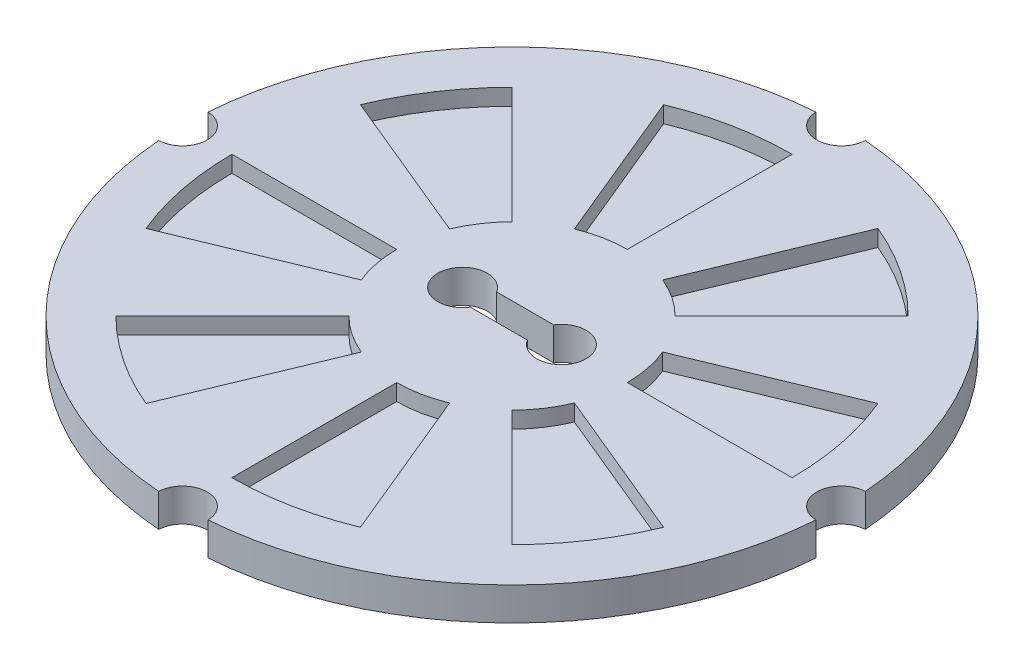
from build123d import *

# Parameters (mm, degrees)
SKETCH1_R           = 127
BOSS_EXTRUDE1_DEPTH = 12.7
CUT_EXTRUDE1_DEPTH  = 6.35
CUT_EXTRUDE2_DEPTH  = 181.05357536
SKETCH4_R           = 9.525
CUT_EXTRUDE3_DEPTH  = 181.05357536


with BuildPart() as part:
    # Sketch1 → Boss-Extrude1 (new body)
    with BuildSketch(Plane(origin=(0, 0, 0), x_dir=(1, 0, 0), z_dir=(0, 1, 0))):
        with Locations(Location((0, 0, 0), (0, 0, 90))):
            Circle(SKETCH1_R)
    extrude(amount=BOSS_EXTRUDE1_DEPTH)

    # Sketch2 → Cut-Extrude1 (cut)
    with BuildSketch(Plane(origin=(0, 12.7, 0), x_dir=(1, 0, 0), z_dir=(0, 1, 0))):
        with BuildLine():
            Line((44.45, 0), (107.95, 0))
            ThreePointArc((107.95, 0), (105.87577102, 21.060000262), (99.732795535, 41.310676524))
            Line((99.732795535, 41.310676524), (41.06644522, 17.010278569))
            ThreePointArc((41.06644522, 17.010278569), (43.595905714, 8.671764814), (44.45, 0))
        make_face()
        with BuildLine():
            Line((41.06644522, -17.010278569), (99.732795535, -41.310676524))
            ThreePointArc((99.732795535, -41.310676524), (89.757144648, -59.973806654), (76.332177029, -76.332177029))
            Line((76.332177029, -76.332177029), (31.430896424, -31.430896424))
            ThreePointArc((31.430896424, -31.430896424), (36.958824267, -24.695096858), (41.06644522, -17.010278569))
        make_face()
        with BuildLine():
            Line((17.010278569, -41.06644522), (41.310676524, -99.732795535))
            ThreePointArc((41.310676524, -99.732795535), (21.060000262, -105.87577102), (0, -107.95))
            Line((0, -107.95), (0, -44.45))
            ThreePointArc((0, -44.45), (8.671764814, -43.595905714), (17.010278569, -41.06644522))
        make_face()
        with BuildLine():
            Line((-17.010278569, -41.06644522), (-41.310676524, -99.732795535))
            ThreePointArc((-41.310676524, -99.732795535), (-59.973806654, -89.757144648), (-76.332177029, -76.332177029))
            Line((-76.332177029, -76.332177029), (-31.430896424, -31.430896424))
            ThreePointArc((-31.430896424, -31.430896424), (-24.695096858, -36.958824267), (-17.010278569, -41.06644522))
        make_face()
        with BuildLine():
            Line((-41.06644522, -17.010278569), (-99.732795535, -41.310676524))
            ThreePointArc((-99.732795535, -41.310676524), (-105.87577102, -21.060000262), (-107.95, 0))
            Line((-107.95, 0), (-44.45, 0))
            ThreePointArc((-44.45, 0), (-43.595905714, -8.671764814), (-41.06644522, -17.010278569))
        make_face()
        with BuildLine():
            Line((-41.06644522, 17.010278569), (-99.732795535, 41.310676524))
            ThreePointArc((-99.732795535, 41.310676524), (-89.757144648, 59.973806654), (-76.332177029, 76.332177029))
            Line((-76.332177029, 76.332177029), (-31.430896424, 31.430896424))
            ThreePointArc((-31.430896424, 31.430896424), (-36.958824267, 24.695096858), (-41.06644522, 17.010278569))
        make_face()
        with BuildLine():
            Line((-17.010278569, 41.06644522), (-41.310676524, 99.732795535))
            ThreePointArc((-41.310676524, 99.732795535), (-21.060000262, 105.87577102), (0, 107.95))
            Line((0, 107.95), (0, 44.45))
            ThreePointArc((0, 44.45), (-8.671764814, 43.595905714), (-17.010278569, 41.06644522))
        make_face()
        with BuildLine():
            Line((17.010278569, 41.06644522), (41.310676524, 99.732795535))
            ThreePointArc((41.310676524, 99.732795535), (59.973806654, 89.757144648), (76.332177029, 76.332177029))
            Line((76.332177029, 76.332177029), (31.430896424, 31.430896424))
            ThreePointArc((31.430896424, 31.430896424), (24.695096858, 36.958824267), (17.010278569, 41.06644522))
        make_face()
    extrude(amount=-CUT_EXTRUDE1_DEPTH, mode=Mode.SUBTRACT)

    # Sketch3 → Cut-Extrude2 (cut, through all)
    with BuildSketch(Plane(origin=(0, 12.7, 0), x_dir=(1, 0, 0), z_dir=(0, 1, 0))):
        with BuildLine():
            Line((-10.992753262, 5.08), (10.992753262, 5.08))
            ThreePointArc((10.992753262, 5.08), (28.575, 0), (10.992753262, -5.08))
            Line((10.992753262, -5.08), (-10.992753262, -5.08))
            ThreePointArc((-10.992753262, -5.08), (-28.575, 0), (-10.992753262, 5.08))
        make_face()
    extrude(amount=-CUT_EXTRUDE2_DEPTH, mode=Mode.SUBTRACT)

    # Sketch4 → Cut-Extrude3 (cut, through all)
    with BuildSketch(Plane(origin=(0, 12.7, 0), x_dir=(1, 0, 0), z_dir=(0, 1, 0))):
        with Locations((127, 0)):
            Circle(SKETCH4_R)
        with Locations((-127, 0)):
            Circle(SKETCH4_R)
        with Locations((0, 127)):
            Circle(SKETCH4_R)
        with Locations((0, -127)):
            Circle(SKETCH4_R)
    extrude(amount=-CUT_EXTRUDE3_DEPTH, mode=Mode.SUBTRACT)


solid = part.part
